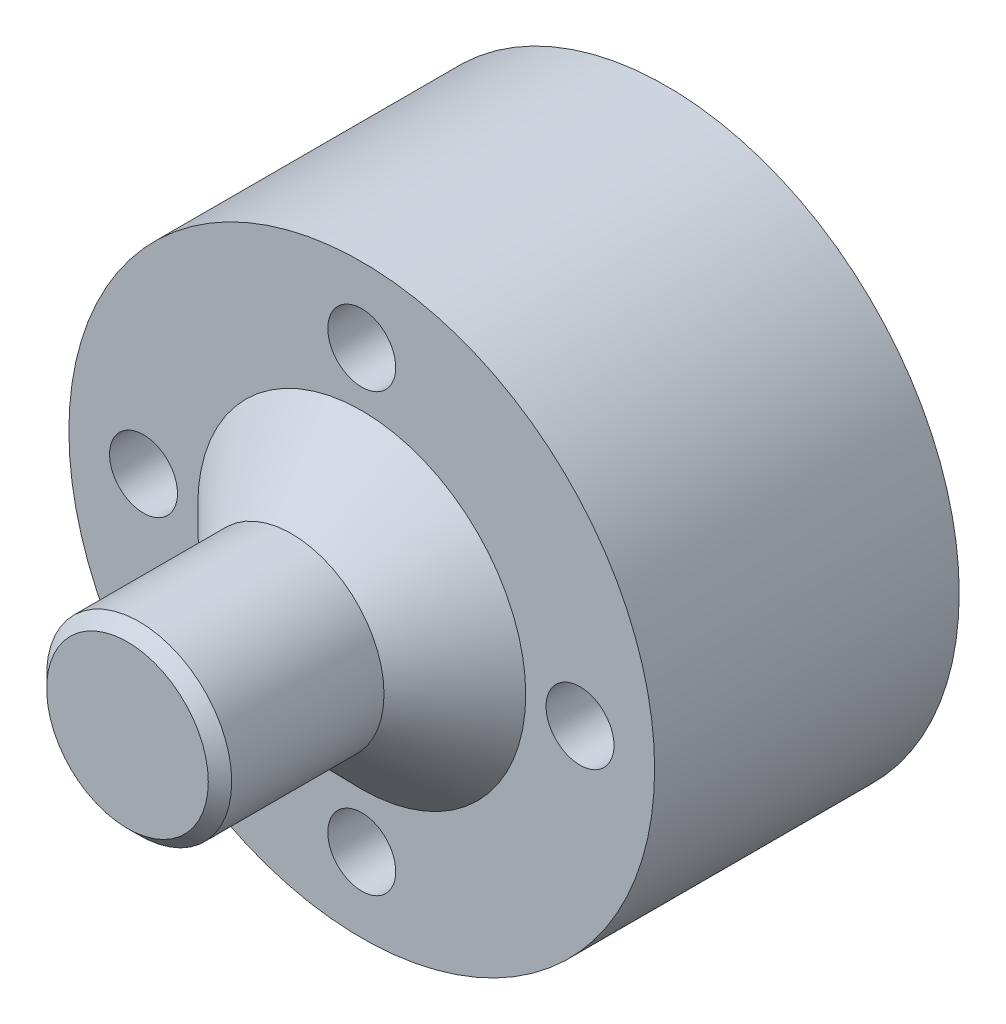
from build123d import *

# Parameters (mm, degrees)
SKETCH1_R           = 12.5
BOSS_EXTRUDE1_DEPTH = 4
CUT_EXTRUDE1_REACH  = 21.404
SKETCH8_W           = 12.25
SKETCH8_H           = 12.25
SKETCH11_R          = 1.45
CUT_EXTRUDE4_DEPTH  = 20.403607912
BOSS_EXTRUDE2_START = 5
SKETCH14_R          = 12.5
BOSS_EXTRUDE2_DEPTH = 5
SKETCH15_R          = 3.95
BOSS_EXTRUDE3_DEPTH = 7
CHAMFER1_SIZE       = 0.5
SKETCH18_R          = 1.45
CUT_EXTRUDE6_DEPTH  = 30


with BuildPart() as part:
    # Sketch1 → Boss-Extrude1 (new, symmetric)
    with BuildSketch(Plane.XY):
        Circle(SKETCH1_R)
    extrude(amount=BOSS_EXTRUDE1_DEPTH, both=True)

    # Sketch8 → Cut-Extrude1 (cut, up to next)
    with BuildSketch(Plane.XY.offset(4), mode=Mode.PRIVATE) as cut_extrude1_sk1:
        Rectangle(SKETCH8_W, SKETCH8_H)
    cut_extrude1_tool1 = extrude(cut_extrude1_sk1.sketch, amount=-CUT_EXTRUDE1_REACH, mode=Mode.PRIVATE) & part.part
    add(cut_extrude1_tool1.solids().sort_by_distance((0, 0, 4))[0], mode=Mode.SUBTRACT)

    # Sketch11 → Cut-Extrude4 (cut, through all)
    with BuildSketch(Plane.XY.offset(4)):
        with Locations((9.315, 0)):
            Circle(SKETCH11_R)
        with Locations((0, -9.315)):
            Circle(SKETCH11_R)
        with Locations((-9.315, 0)):
            Circle(SKETCH11_R)
        with Locations((0, 9.315)):
            Circle(SKETCH11_R)
    extrude(amount=-CUT_EXTRUDE4_DEPTH, mode=Mode.SUBTRACT)

    # Sketch14 → Boss-Extrude2 (add)
    with BuildSketch(Plane.XY.offset(4).offset(BOSS_EXTRUDE2_START)):
        Circle(SKETCH14_R)
    extrude(amount=-BOSS_EXTRUDE2_DEPTH)

    # Sketch13 → Revolve1 (revolve)
    with BuildSketch(Plane(origin=(0, 0, 0), x_dir=(1, 0, 0), z_dir=(0, 1, 0)), mode=Mode.PRIVATE) as revolve1_sk:
        Polygon((0, -12), (3.95, -12), (7.5, -8.506732209), (0, -8.506732209), align=None)
    revolve(revolve1_sk.sketch.rotate(Axis((0, 0, 11.965062333), (0, 0, 1)), 180), axis=Axis((0, 0, 11.965062333), (0, 0, 1)))

    # Sketch15 → Boss-Extrude3 (add)
    with BuildSketch(Plane.XY.offset(12)):
        Circle(SKETCH15_R)
    extrude(amount=BOSS_EXTRUDE3_DEPTH)

    # Chamfer1
    chamfer1_edges = [part.edges().sort_by_distance(p)[0] for p in [
        (-3.95, 0, 19),
    ]]
    chamfer(chamfer1_edges, length=CHAMFER1_SIZE)

    # Sketch18 → Cut-Extrude6 (cut)
    with BuildSketch(Plane.XY.offset(9)):
        with Locations((-9.315, 0)):
            Circle(SKETCH18_R)
        with Locations((0, -9.315)):
            Circle(SKETCH18_R)
        with Locations((9.315, 0)):
            Circle(SKETCH18_R)
        with Locations((0, 9.315)):
            Circle(SKETCH18_R)
    extrude(amount=-CUT_EXTRUDE6_DEPTH, mode=Mode.SUBTRACT)


solid = part.part
